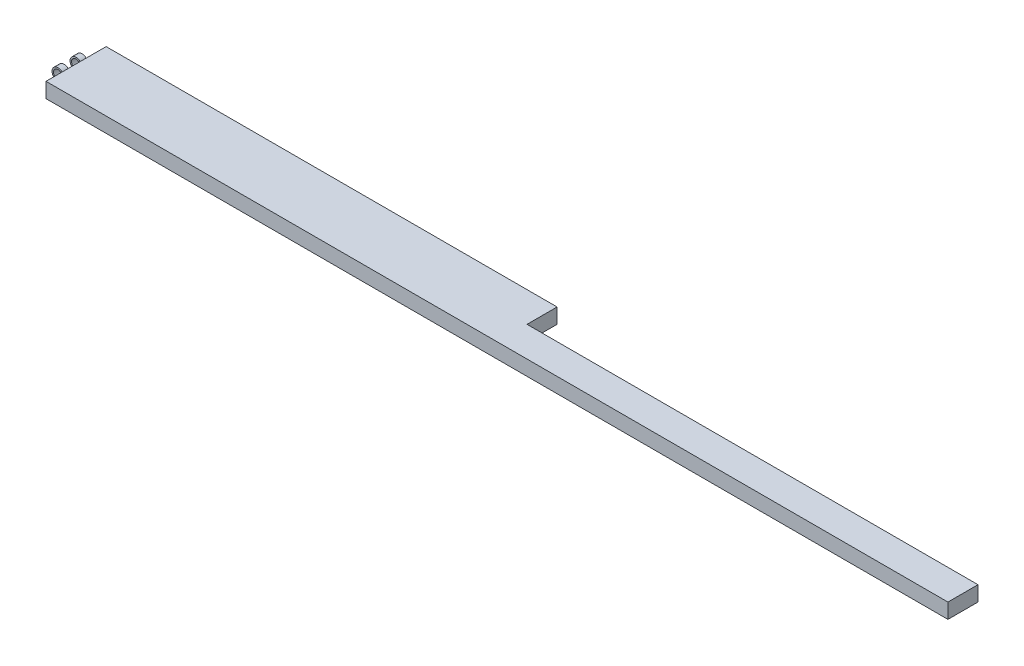
from build123d import *

# Parameters (mm, degrees)
BOSS_EXTRUDE1_DEPTH      = 6.35
BOSS_EXTRUDE2_DEPTH      = 5.08
BOSS_EXTRUDE2_DEPTH_BACK = 5.08
SKETCH2_R                = 2.54
SKETCH2_R_2              = 1.905
CUT_EXTRUDE1_DEPTH       = 2.54
CUT_EXTRUDE1_DEPTH_BACK  = 2.54
SKETCH3_R                = 2.54
SKETCH3_R_2              = 1.905


with BuildPart() as part:
    # Sketch1 → Boss-Extrude1 (new body)
    with BuildSketch(Plane(origin=(0, 0, 0), x_dir=(1, 0, 0), z_dir=(0, 1, 0))):
        Polygon((190.5, 25.4), (190.5, 12.7), (381, 12.7), (381, 0), (0, 0), (0, 25.4), align=None)
    extrude(amount=BOSS_EXTRUDE1_DEPTH)


with BuildPart() as body_2:
    # Sketch2 → Boss-Extrude2 (new, two sides: drawn at the far end of the back side and taken through both)
    with BuildSketch(Plane.XY.offset(-12.7).offset(-BOSS_EXTRUDE2_DEPTH_BACK)):
        with Locations((-2.54, 3.712588247)):
            Circle(SKETCH2_R)
        with Locations((-2.54, 3.712588247)):
            Circle(SKETCH2_R_2, mode=Mode.SUBTRACT)
    extrude(amount=BOSS_EXTRUDE2_DEPTH + BOSS_EXTRUDE2_DEPTH_BACK)

    # Sketch3 → Cut-Extrude1 (cut, two sides: drawn at the far end of the back side and taken through both)
    with BuildSketch(Plane.XY.offset(-12.7).offset(-CUT_EXTRUDE1_DEPTH_BACK)):
        with Locations((-2.54, 3.712588247)):
            Circle(SKETCH3_R)
        with Locations((-2.54, 3.712588247)):
            Circle(SKETCH3_R_2, mode=Mode.SUBTRACT)
    extrude(amount=CUT_EXTRUDE1_DEPTH + CUT_EXTRUDE1_DEPTH_BACK, mode=Mode.SUBTRACT)


with BuildPart() as cut_extrude1_piece_1:
    # of the separate pieces the step leaves, piece 1, a body of its own (cut_extrude1_pieces)
    add(body_2.part.solids().sort_by_distance((0, 3.712588247, -15.24))[0])


with BuildPart() as cut_extrude1_piece_2:
    # of the separate pieces the step leaves, piece 2, a body of its own (cut_extrude1_pieces)
    add(body_2.part.solids().sort_by_distance((0, 3.712588247, -10.16))[0])


solid = Compound([part.part, cut_extrude1_piece_1.part, cut_extrude1_piece_2.part])
